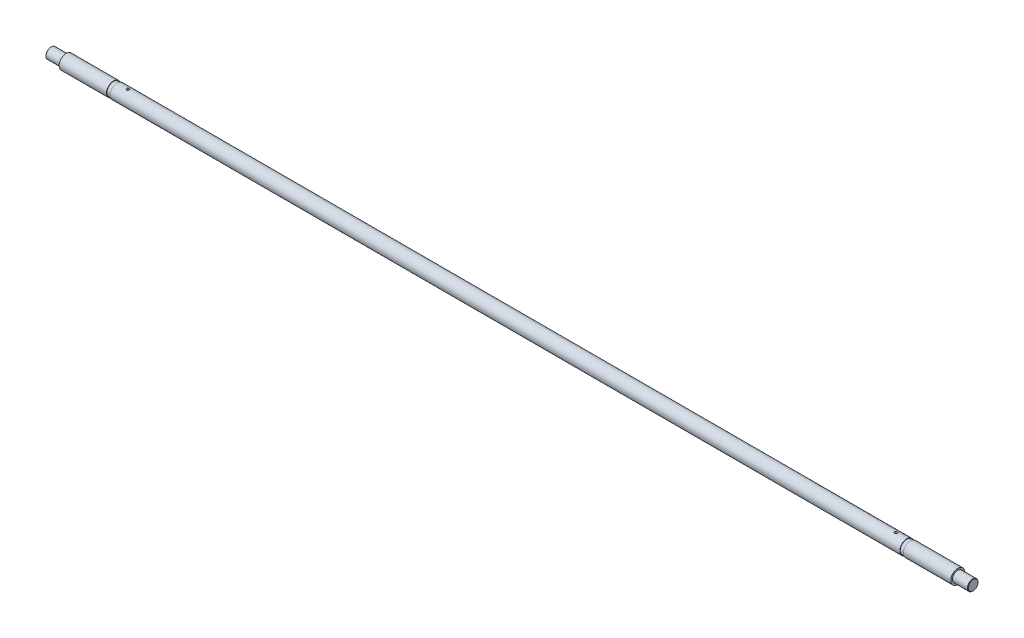
from build123d import *

# Parameters (mm, degrees)
SKETCH1_R      = 12.7
EXTRUDE1_DEPTH = 800.79215
SKETCH2_R      = 9.5123
EXTRUDE2_DEPTH = 828.294
SKETCH3_W      = 6.35
SKETCH3_H      = 0.79375
SKETCH4_R      = 2.38125
EXTRUDE3_DEPTH = 19.05
CHAMFER1_SIZE  = 0.762


with BuildPart() as part:
    # Sketch1 → Extrude1 (new, symmetric)
    with BuildSketch(Plane(origin=(0, 0, 0), x_dir=(0, 0, -1), z_dir=(1, 0, 0))):
        Circle(SKETCH1_R)
    extrude(amount=EXTRUDE1_DEPTH, both=True)

    # Sketch2 → Extrude2 (add, symmetric)
    with BuildSketch(Plane(origin=(0, 0, 0), x_dir=(0, 0, -1), z_dir=(1, 0, 0))):
        Circle(SKETCH2_R)
    extrude(amount=EXTRUDE2_DEPTH, both=True)

    # Sketch3 → Cut-Revolve1 (revolve, cut)
    with BuildSketch(Plane.XY):
        with Locations((-712.4065, 12.303125)):
            Rectangle(SKETCH3_W, SKETCH3_H)
        with Locations((712.4065, 12.303125)):
            Rectangle(SKETCH3_W, SKETCH3_H)
    revolve(axis=Axis((800.79215, 0, 0), (-1, 0, 0)), mode=Mode.SUBTRACT)

    # Sketch4 → Extrude3 (cut, symmetric)
    with BuildSketch(Plane(origin=(0, 0, 0), x_dir=(1, 0, 0), z_dir=(0, 1, 0))):
        with Locations((-689.5973, 0)):
            Circle(SKETCH4_R)
        with Locations((689.5973, 0)):
            Circle(SKETCH4_R)
    extrude(amount=EXTRUDE3_DEPTH, both=True, mode=Mode.SUBTRACT)

    # Chamfer1
    chamfer1_edges = [part.edges().sort_by_distance(p)[0] for p in [
        (-828.294, 0, 9.5123),
        (828.294, 0, 9.5123),
    ]]
    chamfer(chamfer1_edges, length=CHAMFER1_SIZE)


solid = part.part
